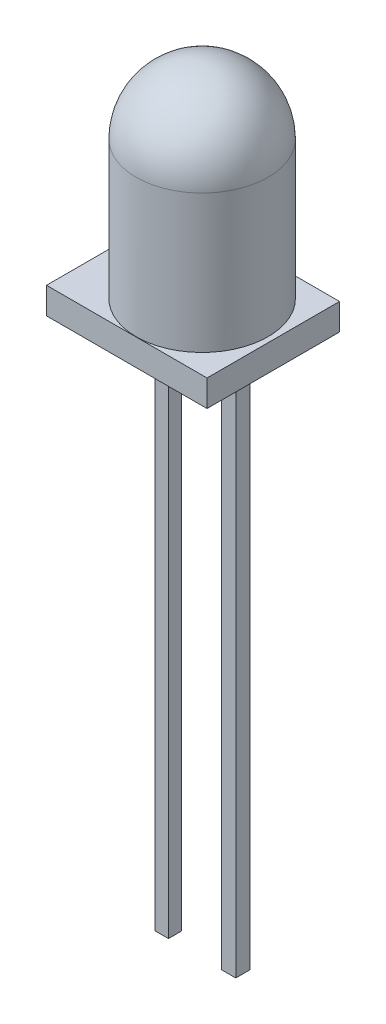
from build123d import *

# Parameters (mm, degrees)
SKETCH1_W           = 2.49
SKETCH1_H           = 5.21
SKETCH2_W           = 6.057828243
SKETCH2_H           = 1
BOSS_EXTRUDE2_DEPTH = 2.5
SKETCH4_W           = 0.5
SKETCH4_H           = 0.5
SKETCH4_W_2         = 0.535652732
SKETCH4_H_2         = 0.535652732
BOSS_EXTRUDE3_DEPTH = 20.3


with BuildPart() as part:
    # Sketch1 → Revolve3 (revolve)
    with BuildSketch(Plane.XY, mode=Mode.PRIVATE) as revolve3_sk:
        with Locations((1.245, -2.605)):
            Rectangle(SKETCH1_W, SKETCH1_H)
        with BuildLine():
            Line((0, 0), (2.49, 0))
            ThreePointArc((2.49, 0), (1.760695885, 1.760695885), (0, 2.49))
            Line((0, 2.49), (0, 0))
        make_face()
    revolve(revolve3_sk.sketch.rotate(Axis((0, 2.49, 0), (0, -1, 0)), 180), axis=Axis((0, 2.49, 0), (0, -1, 0)))

    # Sketch2 → Boss-Extrude2 (add, symmetric)
    with BuildSketch(Plane.XY):
        with Locations((-0.344367629, -5.71)):
            Rectangle(SKETCH2_W, SKETCH2_H)
    extrude(amount=BOSS_EXTRUDE2_DEPTH, both=True)

    # Sketch4 → Boss-Extrude3 (add)
    with BuildSketch(Plane.XZ.offset(6.21)):
        with Locations((-1.27, 0)):
            Rectangle(SKETCH4_W, SKETCH4_H)
        with Locations((1.27, 0)):
            Rectangle(SKETCH4_W_2, SKETCH4_H_2)
    extrude(amount=BOSS_EXTRUDE3_DEPTH)


solid = part.part
